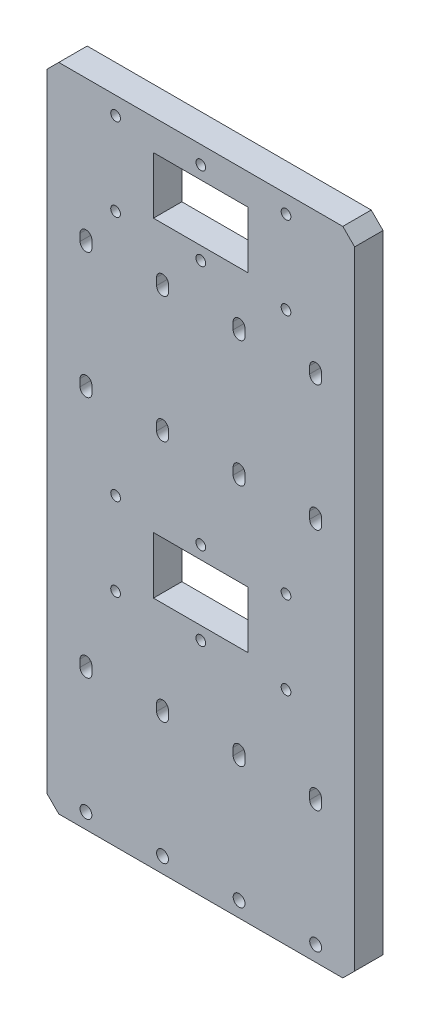
from build123d import *

# Parameters (mm, degrees)
MODEL_R             = 2.5
MODEL_R_2           = 2.05
MODEL_W             = 40
MODEL_H             = 24
BOSS_EXTRUDE1_DEPTH = 12


with BuildPart() as part:
    # Model → Boss-Extrude1 (new body)
    with BuildSketch(Plane.XY):
        Polygon((5, 275), (0, 270), (0, 5), (5, 0), (125, 0), (130, 5), (130, 270), (125, 275), align=None)
        with Locations((16.49, 6.5)):
            Circle(MODEL_R, mode=Mode.SUBTRACT)
        with Locations((48.83, 6.5)):
            Circle(MODEL_R, mode=Mode.SUBTRACT)
        with Locations((81.17, 6.5)):
            Circle(MODEL_R, mode=Mode.SUBTRACT)
        with Locations((113.51, 6.5)):
            Circle(MODEL_R, mode=Mode.SUBTRACT)
        with Locations((29, 128.5)):
            Circle(MODEL_R_2, mode=Mode.SUBTRACT)
        with Locations((65, 128.5)):
            Circle(MODEL_R_2, mode=Mode.SUBTRACT)
        with Locations((101, 128.5)):
            Circle(MODEL_R_2, mode=Mode.SUBTRACT)
        with Locations((101, 93.5)):
            Circle(MODEL_R_2, mode=Mode.SUBTRACT)
        with Locations((65, 93.5)):
            Circle(MODEL_R_2, mode=Mode.SUBTRACT)
        with Locations((29, 93.5)):
            Circle(MODEL_R_2, mode=Mode.SUBTRACT)
        with Locations((29, 267.5)):
            Circle(MODEL_R_2, mode=Mode.SUBTRACT)
        with Locations((65, 267.5)):
            Circle(MODEL_R_2, mode=Mode.SUBTRACT)
        with Locations((101, 267.5)):
            Circle(MODEL_R_2, mode=Mode.SUBTRACT)
        with Locations((101, 232.5)):
            Circle(MODEL_R_2, mode=Mode.SUBTRACT)
        with Locations((65, 232.5)):
            Circle(MODEL_R_2, mode=Mode.SUBTRACT)
        with Locations((29, 232.5)):
            Circle(MODEL_R_2, mode=Mode.SUBTRACT)
        with Locations((65, 111)):
            Rectangle(MODEL_W, MODEL_H, mode=Mode.SUBTRACT)
        with BuildLine():
            Line((13.99, 163.82), (13.99, 160.82))
            ThreePointArc((13.99, 160.82), (16.49, 158.32), (18.99, 160.82))
            Line((18.99, 160.82), (18.99, 163.82))
            ThreePointArc((18.99, 163.82), (16.49, 166.32), (13.99, 163.82))
        make_face(mode=Mode.SUBTRACT)
        with BuildLine():
            Line((46.33, 163.82), (46.33, 160.82))
            ThreePointArc((46.33, 160.82), (48.83, 158.32), (51.33, 160.82))
            Line((51.33, 160.82), (51.33, 163.82))
            ThreePointArc((51.33, 163.82), (48.83, 166.32), (46.33, 163.82))
        make_face(mode=Mode.SUBTRACT)
        with BuildLine():
            Line((78.67, 163.82), (78.67, 160.82))
            ThreePointArc((78.67, 160.82), (81.17, 158.32), (83.67, 160.82))
            Line((83.67, 160.82), (83.67, 163.82))
            ThreePointArc((83.67, 163.82), (81.17, 166.32), (78.67, 163.82))
        make_face(mode=Mode.SUBTRACT)
        with BuildLine():
            Line((111.01, 163.82), (111.01, 160.82))
            ThreePointArc((111.01, 160.82), (113.51, 158.32), (116.01, 160.82))
            Line((116.01, 160.82), (116.01, 163.82))
            ThreePointArc((116.01, 163.82), (113.51, 166.32), (111.01, 163.82))
        make_face(mode=Mode.SUBTRACT)
        with BuildLine():
            Line((13.99, 217), (13.99, 214))
            ThreePointArc((13.99, 214), (16.49, 211.5), (18.99, 214))
            Line((18.99, 214), (18.99, 217))
            ThreePointArc((18.99, 217), (16.49, 219.5), (13.99, 217))
        make_face(mode=Mode.SUBTRACT)
        with BuildLine():
            Line((51.33, 214), (51.33, 217))
            ThreePointArc((51.33, 217), (48.83, 219.5), (46.33, 217))
            Line((46.33, 217), (46.33, 214))
            ThreePointArc((46.33, 214), (48.83, 211.5), (51.33, 214))
        make_face(mode=Mode.SUBTRACT)
        with BuildLine():
            Line((83.67, 214), (83.67, 217))
            ThreePointArc((83.67, 217), (81.17, 219.5), (78.67, 217))
            Line((78.67, 217), (78.67, 214))
            ThreePointArc((78.67, 214), (81.17, 211.5), (83.67, 214))
        make_face(mode=Mode.SUBTRACT)
        with BuildLine():
            Line((116.01, 214), (116.01, 217))
            ThreePointArc((116.01, 217), (113.51, 219.5), (111.01, 217))
            Line((111.01, 217), (111.01, 214))
            ThreePointArc((111.01, 214), (113.51, 211.5), (116.01, 214))
        make_face(mode=Mode.SUBTRACT)
        with BuildLine():
            Line((18.99, 58.18), (18.99, 61.18))
            ThreePointArc((18.99, 61.18), (16.49, 63.68), (13.99, 61.18))
            Line((13.99, 61.18), (13.99, 58.18))
            ThreePointArc((13.99, 58.18), (16.49, 55.68), (18.99, 58.18))
        make_face(mode=Mode.SUBTRACT)
        with BuildLine():
            Line((51.33, 58.18), (51.33, 61.18))
            ThreePointArc((51.33, 61.18), (48.83, 63.68), (46.33, 61.18))
            Line((46.33, 61.18), (46.33, 58.18))
            ThreePointArc((46.33, 58.18), (48.83, 55.68), (51.33, 58.18))
        make_face(mode=Mode.SUBTRACT)
        with BuildLine():
            Line((83.67, 58.18), (83.67, 61.18))
            ThreePointArc((83.67, 61.18), (81.17, 63.68), (78.67, 61.18))
            Line((78.67, 61.18), (78.67, 58.18))
            ThreePointArc((78.67, 58.18), (81.17, 55.68), (83.67, 58.18))
        make_face(mode=Mode.SUBTRACT)
        with BuildLine():
            Line((116.01, 58.18), (116.01, 61.18))
            ThreePointArc((116.01, 61.18), (113.51, 63.68), (111.01, 61.18))
            Line((111.01, 61.18), (111.01, 58.18))
            ThreePointArc((111.01, 58.18), (113.51, 55.68), (116.01, 58.18))
        make_face(mode=Mode.SUBTRACT)
        with Locations((65, 250)):
            Rectangle(MODEL_W, MODEL_H, mode=Mode.SUBTRACT)
    extrude(amount=BOSS_EXTRUDE1_DEPTH)


solid = part.part
